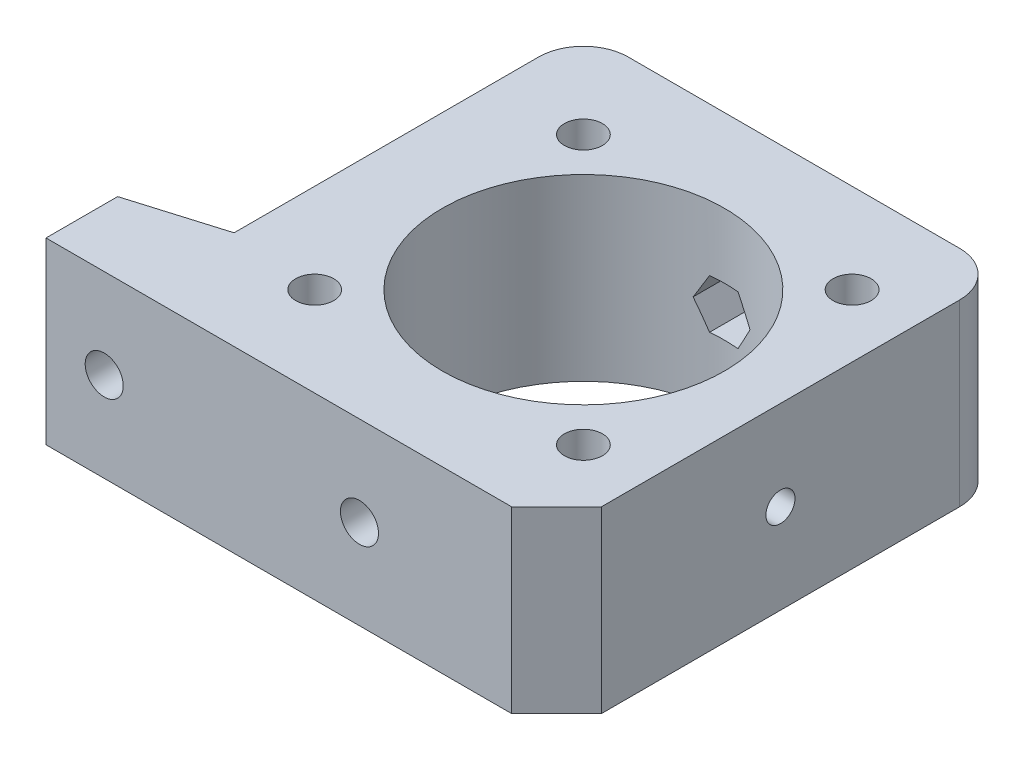
from build123d import *

# Parameters (mm, degrees)
CROQUIS1_R               = 2.125
CROQUIS1_R_2             = 15.75
SALIENTE_EXTRUIR1_DEPTH  = 20
CORTAR_EXTRUIR1_REACH    = 66.226
CROQUIS3_R               = 2.125
CORTAR_EXTRUIR2_REACH    = 71.226
CORTAR_EXTRUIR2_START    = -5
CORTAR_EXTRUIR3_DEPTH    = 10
SKETCH1_W                = 3
SKETCH1_H                = 60
CUT_EXTRUDE1_DEPTH       = 48.434164903
REDONDEO1_R              = 5
CUT_EXTRUDE2_DEPTH       = 48.434164903
SKETCH3_R                = 1.625
CUT_EXTRUDE3_DEPTH       = 10
CUT_EXTRUDE4_REACH       = 71.376
CUT_EXTRUDE4_END_RADIUS  = 15.75
CUT_EXTRUDE4_START       = -4
CUT_EXTRUDE5_REACH       = 66.226
CUT_EXTRUDE5_END_RADIUS  = 15.75
SKETCH5_R                = 1.625
CUT_EXTRUDE6_REACH       = 70.226
CUT_EXTRUDE6_END_RADIUS  = 15.75
CUT_EXTRUDE6_START       = -4
REDONDEO1_OF_SIMETR_A1_R = 5
CROQUIS6_W               = 57
CROQUIS6_H               = 20
CORTAR_EXTRUIR4_DEPTH    = 73.972597597
CROQUIS7_W               = 57
CROQUIS7_H               = 20
CORTAR_EXTRUIR5_DEPTH    = 73.972597597


with BuildPart() as part:
    # Croquis1 → Saliente-Extruir1 (new body)
    with BuildSketch(Plane(origin=(0, 0, 0), x_dir=(1, 0, 0), z_dir=(0, 1, 0))):
        Polygon((25, 25), (-25, 25), (-25, -14), (-35, -17), (-35, -25), (25, -25), align=None)
        with Locations(Location((-15, -15, 0), (0, 0, 270))):
            Circle(CROQUIS1_R, mode=Mode.SUBTRACT)
        with Locations(Location((15, -15, 0), (0, 0, 270))):
            Circle(CROQUIS1_R, mode=Mode.SUBTRACT)
        with Locations(Location((-15, 15, 0), (0, 0, 270))):
            Circle(CROQUIS1_R, mode=Mode.SUBTRACT)
        with Locations(Location((0, 0, 0), (0, 0, 270))):
            Circle(CROQUIS1_R_2, mode=Mode.SUBTRACT)
        with Locations(Location((15, 15, 0), (0, 0, 270))):
            Circle(CROQUIS1_R, mode=Mode.SUBTRACT)
    saliente_extruir1 = extrude(amount=-SALIENTE_EXTRUIR1_DEPTH)

    # Croquis3 → Cortar-Extruir1 (cut, up to next)
    with BuildSketch(Plane.XY.offset(25), mode=Mode.PRIVATE) as cortar_extruir1_sk1:
        with Locations((-28.5, -10)):
            Circle(CROQUIS3_R)
    cortar_extruir1_tool1 = extrude(cortar_extruir1_sk1.sketch, amount=-CORTAR_EXTRUIR1_REACH, mode=Mode.PRIVATE) & part.part
    # Croquis3 → Cortar-Extruir1 (cut, up to next)
    with BuildSketch(Plane.XY.offset(25), mode=Mode.PRIVATE) as cortar_extruir1_sk2:
        with Locations((0, -10)):
            Circle(CROQUIS3_R)
    cortar_extruir1_tool2 = extrude(cortar_extruir1_sk2.sketch, amount=-CORTAR_EXTRUIR1_REACH, mode=Mode.PRIVATE) & part.part
    cortar_extruir1_1 = cortar_extruir1_tool1.solids().sort_by_distance((-28.5, -10, 25))[0]
    add(cortar_extruir1_1, mode=Mode.SUBTRACT)
    cortar_extruir1_2 = cortar_extruir1_tool2.solids().sort_by_distance((0, -10, 25))[0]
    add(cortar_extruir1_2, mode=Mode.SUBTRACT)
    cortar_extruir1 = cortar_extruir1_1 + cortar_extruir1_2  # Cortar-Extruir1 as one shape, for the pattern or mirror that repeats it

    # Croquis4 → Cortar-Extruir2 (cut, up to next)
    with BuildSketch(Plane.XY.offset(25).offset(CORTAR_EXTRUIR2_START), mode=Mode.PRIVATE) as cortar_extruir2_sk1:
        Polygon((-28.5, -14.041451884), (-25, -12.020725942), (-25, -7.979274058), (-28.5, -5.958548116), (-32, -7.979274058), (-32, -12.020725942), align=None)
    cortar_extruir2_tool1 = extrude(cortar_extruir2_sk1.sketch, amount=-CORTAR_EXTRUIR2_REACH, mode=Mode.PRIVATE) & part.part
    # Croquis4 → Cortar-Extruir2 (cut, up to next)
    with BuildSketch(Plane.XY.offset(25).offset(CORTAR_EXTRUIR2_START), mode=Mode.PRIVATE) as cortar_extruir2_sk2:
        Polygon((2.020725942, -13.5), (4.041451884, -10), (2.020725942, -6.5), (-2.020725942, -6.5), (-4.041451884, -10), (-2.020725942, -13.5), align=None)
    cortar_extruir2_tool2 = extrude(cortar_extruir2_sk2.sketch, amount=-CORTAR_EXTRUIR2_REACH, mode=Mode.PRIVATE) & part.part
    cortar_extruir2_1 = cortar_extruir2_tool1.solids().sort_by_distance((-28.5, -10, 20))[0]
    add(cortar_extruir2_1, mode=Mode.SUBTRACT)
    cortar_extruir2_2 = cortar_extruir2_tool2.solids().sort_by_distance((0, -10, 20))[0]
    add(cortar_extruir2_2, mode=Mode.SUBTRACT)
    cortar_extruir2 = cortar_extruir2_1 + cortar_extruir2_2  # Cortar-Extruir2 as one shape, for the pattern or mirror that repeats it

    # Croquis5 → Cortar-Extruir3 (cut)
    with BuildSketch(Plane.XZ.offset(20)):
        Polygon((-11.040489496, 13.939052358), (-12.101437138, 17.898562862), (-16.060947642, 18.959510504), (-18.959510504, 16.060947642), (-17.898562862, 12.101437138), (-13.939052358, 11.040489496), align=None)
        Polygon((11.040489496, 13.939052358), (13.939052358, 11.040489496), (17.898562862, 12.101437138), (18.959510504, 16.060947642), (16.060947642, 18.959510504), (12.101437138, 17.898562862), align=None)
        Polygon((-13.939052358, -11.040489496), (-17.898562862, -12.101437138), (-18.959510504, -16.060947642), (-16.060947642, -18.959510504), (-12.101437138, -17.898562862), (-11.040489496, -13.939052358), align=None)
        Polygon((18.959510504, -16.060947642), (17.898562862, -12.101437138), (13.939052358, -11.040489496), (11.040489496, -13.939052358), (12.101437138, -17.898562862), (16.060947642, -18.959510504), align=None)
    cortar_extruir3 = extrude(amount=-CORTAR_EXTRUIR3_DEPTH, mode=Mode.SUBTRACT)

    # Sketch1 → Cut-Extrude1 (cut, through all)
    with BuildSketch(Plane(origin=(0, 0, 0), x_dir=(1, 0, 0), z_dir=(0, 1, 0))):
        with Locations((23.5, 5)):
            Rectangle(SKETCH1_W, SKETCH1_H)
    cut_extrude1 = extrude(amount=-CUT_EXTRUDE1_DEPTH, mode=Mode.SUBTRACT)

    # Redondeo1
    redondeo1_edges = [part.edges().sort_by_distance(p)[0] for p in [
        (22, -10, -25),
        (-25, -10, -25),
    ]]
    fillet(redondeo1_edges, radius=REDONDEO1_R)

    # Sketch2 → Cut-Extrude2 (cut, through all)
    with BuildSketch(Plane(origin=(0, 0, 0), x_dir=(1, 0, 0), z_dir=(0, 1, 0))):
        Polygon((22, -25), (22, -20), (17, -25), align=None)
    cut_extrude2 = extrude(amount=-CUT_EXTRUDE2_DEPTH, mode=Mode.SUBTRACT)

    # Sketch3 → Cut-Extrude3 (cut)
    with BuildSketch(Plane(origin=(22, 0, 0), x_dir=(0, 0, -1), z_dir=(1, 0, 0))):
        with Locations((0, -10)):
            Circle(SKETCH3_R)
    cut_extrude3 = extrude(amount=-CUT_EXTRUDE3_DEPTH, mode=Mode.SUBTRACT)

    # Cut-Extrude4: up to this cylinder (the profile starts outside it)
    cut_extrude4_end = Plane(origin=(0, -10, 0), z_dir=(0, 1, 0)) * Cylinder(CUT_EXTRUDE4_END_RADIUS, 175.252, mode=Mode.PRIVATE)
    # Sketch4 → Cut-Extrude4 (cut, up to the surface)
    with BuildSketch(Plane(origin=(22, 0, 0), x_dir=(0, 0, -1), z_dir=(1, 0, 0)).offset(CUT_EXTRUDE4_START), mode=Mode.PRIVATE) as cut_extrude4_sk1:
        Polygon((1.58771324, -12.75), (3.175426481, -10), (1.58771324, -7.25), (-1.58771324, -7.25), (-3.175426481, -10), (-1.58771324, -12.75), align=None)
    cut_extrude4_tool1 = extrude(cut_extrude4_sk1.sketch, amount=-CUT_EXTRUDE4_REACH, mode=Mode.PRIVATE) - cut_extrude4_end
    cut_extrude4 = cut_extrude4_tool1.solids().sort_by_distance((18, -10, 0))[0]
    add(cut_extrude4, mode=Mode.SUBTRACT)

    # Cut-Extrude5: up to this cylinder (the profile starts outside it)
    cut_extrude5_end = Plane(origin=(0, -10, 0), z_dir=(0, 1, 0)) * Cylinder(CUT_EXTRUDE5_END_RADIUS, 164.952, mode=Mode.PRIVATE)
    # Sketch5 → Cut-Extrude5 (cut, up to the surface)
    with BuildSketch(Plane(origin=(0, 0, -25), x_dir=(-1, 0, 0), z_dir=(0, 0, -1)), mode=Mode.PRIVATE) as cut_extrude5_sk1:
        with Locations((0, -10)):
            Circle(SKETCH5_R)
    cut_extrude5_tool1 = extrude(cut_extrude5_sk1.sketch, amount=-CUT_EXTRUDE5_REACH, mode=Mode.PRIVATE) - cut_extrude5_end
    cut_extrude5 = cut_extrude5_tool1.solids().sort_by_distance((0, -10, -25))[0]
    add(cut_extrude5, mode=Mode.SUBTRACT)

    # Cut-Extrude6: up to this cylinder (the profile starts outside it)
    cut_extrude6_end = Plane(origin=(0, -10, 0), z_dir=(0, 1, 0)) * Cylinder(CUT_EXTRUDE6_END_RADIUS, 172.952, mode=Mode.PRIVATE)
    # Sketch6 → Cut-Extrude6 (cut, up to the surface)
    with BuildSketch(Plane(origin=(0, 0, -25), x_dir=(-1, 0, 0), z_dir=(0, 0, -1)).offset(CUT_EXTRUDE6_START), mode=Mode.PRIVATE) as cut_extrude6_sk1:
        Polygon((1.58771324, -12.75), (3.175426481, -10), (1.58771324, -7.25), (-1.58771324, -7.25), (-3.175426481, -10), (-1.58771324, -12.75), align=None)
    cut_extrude6_tool1 = extrude(cut_extrude6_sk1.sketch, amount=-CUT_EXTRUDE6_REACH, mode=Mode.PRIVATE) - cut_extrude6_end
    cut_extrude6 = cut_extrude6_tool1.solids().sort_by_distance((0, -10, -21))[0]
    add(cut_extrude6, mode=Mode.SUBTRACT)

    # Simetría1: Saliente-Extruir1, Cortar-Extruir1, Cortar-Extruir2, Cortar-Extruir3, Cut-Extrude1, Cut-Extrude2, Cut-Extrude3, Cut-Extrude4, Cut-Extrude5, Cut-Extrude6 across plane
    add(saliente_extruir1.mirror(Plane.ZX.offset(-20)))
    add(cortar_extruir1.mirror(Plane.ZX.offset(-20)), mode=Mode.SUBTRACT)
    add(cortar_extruir2.mirror(Plane.ZX.offset(-20)), mode=Mode.SUBTRACT)
    add(cortar_extruir3.mirror(Plane.ZX.offset(-20)), mode=Mode.SUBTRACT)
    add(cut_extrude1.mirror(Plane.ZX.offset(-20)), mode=Mode.SUBTRACT)
    add(cut_extrude2.mirror(Plane.ZX.offset(-20)), mode=Mode.SUBTRACT)
    add(cut_extrude3.mirror(Plane.ZX.offset(-20)), mode=Mode.SUBTRACT)
    add(cut_extrude4.mirror(Plane.ZX.offset(-20)), mode=Mode.SUBTRACT)
    add(cut_extrude5.mirror(Plane.ZX.offset(-20)), mode=Mode.SUBTRACT)
    add(cut_extrude6.mirror(Plane.ZX.offset(-20)), mode=Mode.SUBTRACT)

    # Redondeo1 of Simetría1
    redondeo1_of_simetr_a1_edges = [part.edges().sort_by_distance(p)[0] for p in [
        (22, -30, -25),
        (-25, -30, -25),
    ]]
    fillet(redondeo1_of_simetr_a1_edges, radius=REDONDEO1_OF_SIMETR_A1_R)

    # Croquis6 → Cortar-Extruir4 (cut, through all)
    with BuildSketch(Plane(origin=(0, 0, -25), x_dir=(-1, 0, 0), z_dir=(0, 0, -1))):
        with Locations((6.5, -10)):
            Rectangle(CROQUIS6_W, CROQUIS6_H)
    extrude(amount=-CORTAR_EXTRUIR4_DEPTH, mode=Mode.SUBTRACT)

    # Simetría4: part across plane


with BuildPart() as part_1:
    add(part.part)
    add(part.part.mirror(Plane(origin=(22, -20, 25), x_dir=(0, 0, 1), z_dir=(0, -1, 0))))

    # Croquis7 → Cortar-Extruir5 (cut, through all)
    with BuildSketch(Plane(origin=(0, 0, -25), x_dir=(-1, 0, 0), z_dir=(0, 0, -1))):
        with Locations((6.5, -30)):
            Rectangle(CROQUIS7_W, CROQUIS7_H)
    extrude(amount=-CORTAR_EXTRUIR5_DEPTH, mode=Mode.SUBTRACT)


solid = part_1.part
